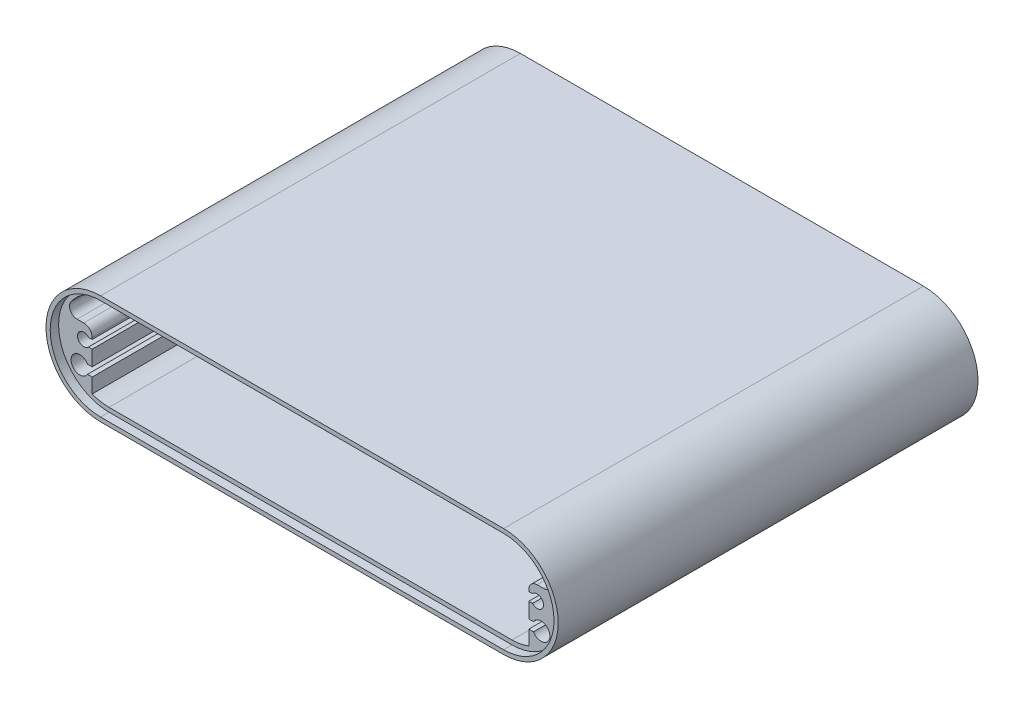
from build123d import *

# Parameters (mm, degrees)
BOSS_EXTRUDE1_DEPTH      = 25
BOSS_EXTRUDE1_DEPTH_BACK = 25
CUT_EXTRUDE1_DEPTH       = 1


with BuildPart() as part:
    # Sketch1 → Boss-Extrude1 (new, two sides: drawn at the far end of the back side and taken through both)
    with BuildSketch(Plane.XY.offset(-BOSS_EXTRUDE1_DEPTH_BACK)):
        with BuildLine():
            Line((24, 6.5), (-24, 6.5))
            ThreePointArc((-24, 6.5), (-30.5, 0), (-24, -6.5))
            Line((-24, -6.5), (24, -6.5))
            ThreePointArc((24, -6.5), (30.5, 0), (24, 6.5))
        make_face()
        with BuildLine():
            Line((24, 5.5), (-24, 5.5))
            ThreePointArc((-24, 5.5), (-26.564388223, 4.865584553), (-28.537180991, 3.108695652))
            ThreePointArc((-28.537180991, 3.108695652), (-28.590919755, 2.180372836), (-27.794733192, 1.7))
            Line((-27.794733192, 1.7), (-27, 1.7))
            ThreePointArc((-27, 1.7), (-26.292893219, 1.407106781), (-26, 0.7))
            Line((-26, 0.7), (-26, 0.5))
            Line((-26, 0.5), (-26.440983006, 0.5))
            ThreePointArc((-26.440983006, 0.5), (-27.75, 0), (-26.440983006, -0.5))
            Line((-26.440983006, -0.5), (-26, -0.5))
            Line((-26, -0.5), (-26, -2.325))
            Line((-26, -2.325), (-26.555673326, -2.325))
            ThreePointArc((-26.555673326, -2.325), (-28.515, -2.85), (-26.555673326, -3.375))
            Line((-26.555673326, -3.375), (-26, -3.375))
            Line((-26, -3.375), (-26, -5.123475383))
            ThreePointArc((-26, -5.123475383), (-25.017567048, -5.405049242), (-24, -5.5))
            Line((-24, -5.5), (24, -5.5))
            ThreePointArc((24, -5.5), (25.017567048, -5.405049242), (26, -5.123475383))
            Line((26, -5.123475383), (26, -3.375))
            Line((26, -3.375), (26.555673326, -3.375))
            ThreePointArc((26.555673326, -3.375), (28.515, -2.85), (26.555673326, -2.325))
            Line((26.555673326, -2.325), (26, -2.325))
            Line((26, -2.325), (26, -0.5))
            Line((26, -0.5), (26.440983006, -0.5))
            ThreePointArc((26.440983006, -0.5), (27.75, 0), (26.440983006, 0.5))
            Line((26.440983006, 0.5), (26, 0.5))
            Line((26, 0.5), (26, 0.7))
            ThreePointArc((26, 0.7), (26.292893219, 1.407106781), (27, 1.7))
            Line((27, 1.7), (27.794733192, 1.7))
            ThreePointArc((27.794733192, 1.7), (28.590919755, 2.180372836), (28.537180991, 3.108695652))
            ThreePointArc((28.537180991, 3.108695652), (26.564388223, 4.865584553), (24, 5.5))
        make_face(mode=Mode.SUBTRACT)
    extrude(amount=BOSS_EXTRUDE1_DEPTH + BOSS_EXTRUDE1_DEPTH_BACK)

    # Sketch2 → Cut-Extrude1 (cut)
    with BuildSketch(Plane.XY.offset(25)):
        with BuildLine():
            Line((24, 6), (-24, 6))
            ThreePointArc((-24, 6), (-30, 0), (-24, -6))
            Line((-24, -6), (24, -6))
            ThreePointArc((24, -6), (30, 0), (24, 6))
        make_face()
    cut_extrude1 = extrude(amount=-CUT_EXTRUDE1_DEPTH, mode=Mode.SUBTRACT)

    # Mirror1: Cut-Extrude1 across plane
    add(cut_extrude1.mirror(Plane.XY), mode=Mode.SUBTRACT)


solid = part.part
